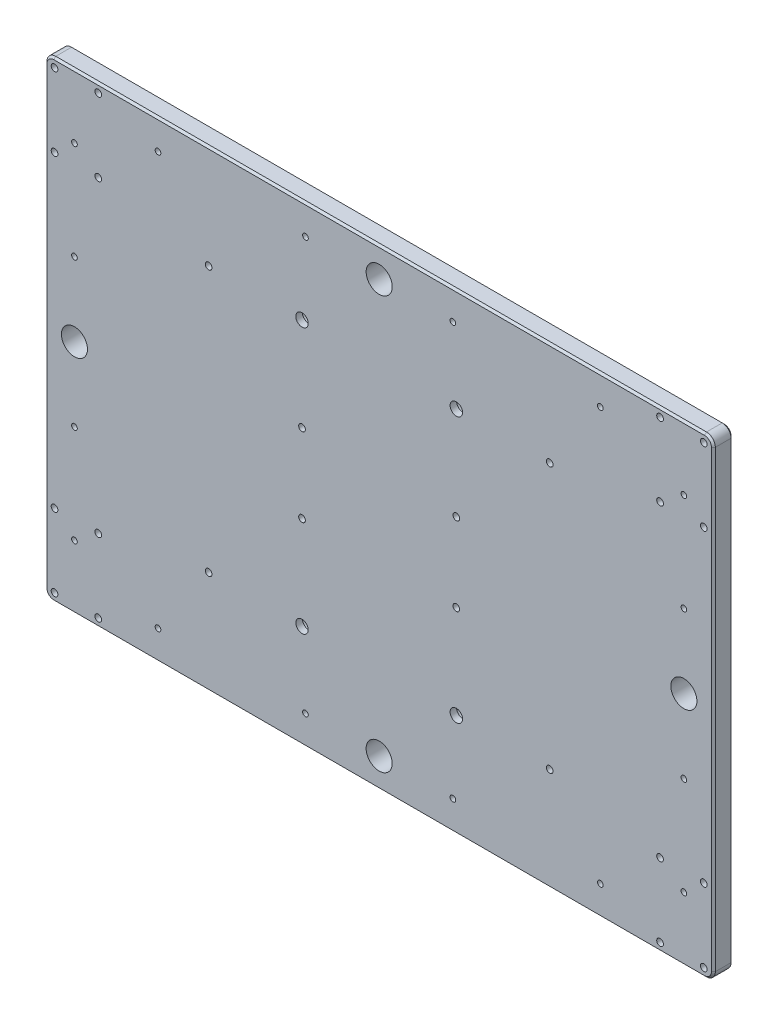
from build123d import *

# Parameters (mm, degrees)
SKETCH_1_W                = 680
SKETCH_1_H                = 480
EXTRUDE_1_DEPTH           = 20
FILLET_1_R                = 9
CHAMFER_3_SIZE            = 2
HOLE_WIZARD_M30_1_D       = 26.5
HOLE_WIZARD_M30_1_DEPTH   = 70.5
HOLE_WIZARD_M30_1_TIP     = 7.961403202
HOLE_WIZARD_M8_1_D        = 6.8
HOLE_WIZARD_2_D           = 6.6
HOLE_WIZARD_2_DEPTH       = 19.75
HOLE_WIZARD_2_CBORE_D     = 11
HOLE_WIZARD_2_CBORE_DEPTH = 6.8
HOLE_WIZARD_2_TIP         = 1.982840043
HOLE_WIZARD_3_D           = 13.5
HOLE_WIZARD_3_DEPTH       = 19.75
HOLE_WIZARD_3_CBORE_D     = 20
HOLE_WIZARD_3_CBORE_DEPTH = 13
HOLE_WIZARD_3_TIP         = 4.055809178
HOLE_WIZARD_M8_2_D        = 6.8


with BuildPart() as part:
    # 草图1 → 凸台-拉伸1 (new body)
    with BuildSketch(Plane.XY):
        Rectangle(SKETCH_1_W, SKETCH_1_H)
    extrude(amount=EXTRUDE_1_DEPTH)

    # 圆角1
    fillet_1_edges = [part.edges().sort_by_distance(p)[0] for p in [
        (340, -240, 10),
        (-340, -240, 10),
        (-340, 240, 10),
        (340, 240, 10),
    ]]
    fillet(fillet_1_edges, radius=FILLET_1_R)

    # 倒角3
    chamfer_3_edges = [part.edges().sort_by_distance(p)[0] for p in [
        (-340, 0, 0),
        (-340, 0, 20),
        (340, 0, 0),
        (0, -240, 0),
        (0, 240, 0),
        (-337.363961031, -237.363961031, 0),
        (337.363961031, -237.363961031, 0),
        (337.363961031, 237.363961031, 0),
        (-337.363961031, 237.363961031, 0),
        (0, 240, 20),
        (340, 0, 20),
        (0, -240, 20),
        (-337.363961031, -237.363961031, 20),
        (337.363961031, -237.363961031, 20),
        (337.363961031, 237.363961031, 20),
        (-337.363961031, 237.363961031, 20),
    ]]
    chamfer(chamfer_3_edges, length=CHAMFER_3_SIZE)

    # M30 螺纹孔1
    with Locations(Plane(origin=(0, 0, 0), x_dir=(-1, 0, 0), z_dir=(0, 0, -1))):
        with Locations((0, 210), (-310, 0), (0, -210), (310, 0)):
            Hole(HOLE_WIZARD_M30_1_D / 2, depth=HOLE_WIZARD_M30_1_DEPTH)
            with Locations((0, 0, -(HOLE_WIZARD_M30_1_DEPTH + HOLE_WIZARD_M30_1_TIP / 2))):  # 118° drill point
                Cone(0, HOLE_WIZARD_M30_1_D / 2, HOLE_WIZARD_M30_1_TIP, mode=Mode.SUBTRACT)

    # M8 螺纹孔1 (through all)
    with Locations(Plane(origin=(0, 0, 0), x_dir=(-1, 0, 0), z_dir=(0, 0, -1))):
        with Locations((330.25, -231.25), (285.75, -231.25), (285.75, -156.75), (330.25, -156.75), (-285.75, -231.25), (-330.25, -231.25), (-330.25, -156.75), (-285.75, -156.75), (330.25, 156.75), (285.75, 156.75), (285.75, 231.25), (330.25, 231.25), (-285.75, 156.75), (-330.25, 156.75), (-330.25, 231.25), (-285.75, 231.25)):
            Hole(HOLE_WIZARD_M8_1_D / 2)

    # 打孔尺寸(%根据)内六角圆柱头螺钉的类型2
    with Locations(Plane(origin=(0, 0, 0), x_dir=(-1, 0, 0), z_dir=(0, 0, -1))):
        with Locations((225, -210), (75, -210), (-75, -210), (-225, -210), (225, 210), (75, 210), (-75, 210), (-225, 210), (310, -175), (310, 175), (-310, -175), (-310, 175), (-310, -75), (-310, 75), (310, -75), (310, 75)):
            CounterBoreHole(HOLE_WIZARD_2_D / 2, HOLE_WIZARD_2_CBORE_D / 2, HOLE_WIZARD_2_CBORE_DEPTH, depth=HOLE_WIZARD_2_DEPTH)
            with Locations((0, 0, -(HOLE_WIZARD_2_DEPTH + HOLE_WIZARD_2_TIP / 2))):  # 118° drill point
                Cone(0, HOLE_WIZARD_2_D / 2, HOLE_WIZARD_2_TIP, mode=Mode.SUBTRACT)

    # 打孔尺寸(%根据)内六角圆柱头螺钉的类型3
    with Locations(Plane(origin=(0, 0, 0), x_dir=(-1, 0, 0), z_dir=(0, 0, -1))):
        with Locations((78.500000006, -135.000000012), (-78.499999994, -135.000000012), (-78.499999994, 134.999999988), (78.500000006, 134.999999988)):
            CounterBoreHole(HOLE_WIZARD_3_D / 2, HOLE_WIZARD_3_CBORE_D / 2, HOLE_WIZARD_3_CBORE_DEPTH, depth=HOLE_WIZARD_3_DEPTH)
            with Locations((0, 0, -(HOLE_WIZARD_3_DEPTH + HOLE_WIZARD_3_TIP / 2))):  # 118° drill point
                Cone(0, HOLE_WIZARD_3_D / 2, HOLE_WIZARD_3_TIP, mode=Mode.SUBTRACT)

    # M8 螺纹孔2 (through all)
    with Locations(Plane.XY.offset(20)):
        with Locations((-173.5, 135.000000012), (-78.5, 40.000000013), (173.5, 135.000000012), (78.5, 40.000000013), (78.499999997, -39.999999988), (-78.500000003, -39.999999988), (-173.5, -134.999999988), (173.5, -134.999999988)):
            Hole(HOLE_WIZARD_M8_2_D / 2)


solid = part.part
